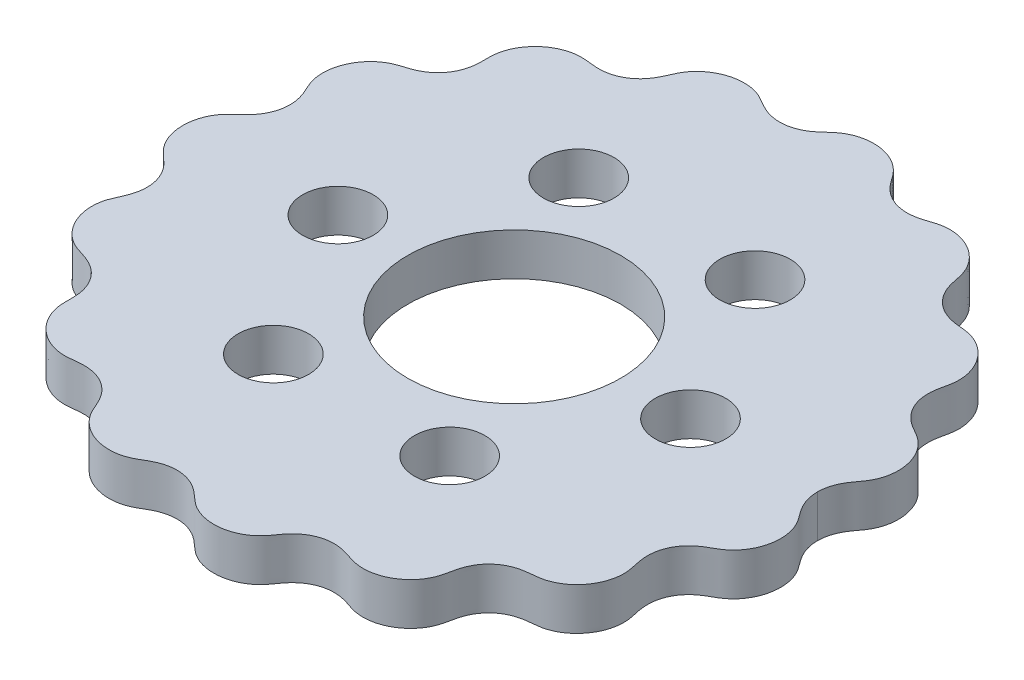
from build123d import *

# Parameters (mm, degrees)
CROQUIS1_R              = 2.5
CROQUIS1_R_2            = 7.55
SALIENTE_EXTRUIR1_DEPTH = 3


with BuildPart() as part:
    # Croquis1 → Saliente-Extruir1 (new body)
    with BuildSketch(Plane(origin=(0, 0, 0), x_dir=(1, 0, 0), z_dir=(0, 1, 0))):
        with BuildLine():
            add(Edge.make_bspline(
                [(21.5, 6e-09), (21.5, -0.021477729), (21.500593167, -0.064403657), (21.503262416, -0.141588523), (21.510372598, -0.2506358), (21.521018274, -0.353523789), (21.535175808, -0.452206948), (21.557222906, -0.575017626), (21.590559678, -0.722889607), (21.639274228, -0.892521131), (21.707884543, -1.081968973), (21.78873173, -1.266690221), (21.888386964, -1.460455943), (22.008607626, -1.661555773), (22.149838228, -1.868528125), (22.309357779, -2.08239167), (22.468686481, -2.296354296), (22.616280308, -2.518934735), (22.777295322, -2.811357303), (22.950547935, -3.239521207), (23.075522685, -3.817302999), (23.078537532, -4.534680376), (22.911713253, -5.29055349), (22.610017793, -5.937401244), (22.218532391, -6.456743933), (21.777242179, -6.851918437), (21.32091858, -7.125069015), (20.800006514, -7.402592951), (20.275278853, -7.794795834), (19.806259526, -8.344649339), (19.47501305, -9.061365972), (19.359808776, -9.783237796), (19.409811075, -10.45223525), (19.534571948, -10.974738813), (19.622228568, -11.37394657), (19.66331962, -11.780870884), (19.655235202, -12.25104806), (19.539094715, -12.841606724), (19.252298774, -13.507573669), (18.793656717, -14.136374174), (18.262226158, -14.603366894), (17.710139852, -14.916745352), (17.169916613, -15.100032746), (16.669993727, -15.175429226), (16.191607921, -15.204772861), (15.741139447, -15.278537815), (15.326751026, -15.399790897), (14.95430103, -15.566061405), (14.526377994, -15.833151099), (14.082742171, -16.242840318), (13.724187686, -16.776104917), (13.513969977, -17.343953181), (13.412285649, -17.804901498), (13.335129122, -18.208112885), (13.235903541, -18.607442974), (13.024991152, -19.108148449), (12.641574276, -19.662684796), (12.102803702, -20.165182222), (11.412158232, -20.563926572), (10.707597414, -20.779266856), (10.035646399, -20.83404745), (9.496566569, -20.766350177), (9.101123729, -20.652617048), (8.713354253, -20.51783079), (8.26331895, -20.375418001), (7.666439407, -20.273547461), (7.02534099, -20.317432866), (6.448722445, -20.496787609), (6.003453554, -20.733835755), (5.673235715, -20.973250267), (5.36103011, -21.271497292), (5.071919671, -21.624726769), (4.807303774, -22.024358247), (4.49206196, -22.419593303), (4.063197476, -22.795814727), (3.515795305, -23.117216867), (2.845595233, -23.344001375), (2.071809166, -23.426718685), (1.351516933, -23.342234872), (0.782242843, -23.147337041), (0.370660405, -22.919550473), (0.094685369, -22.719855647), (-0.112499956, -22.543041557), (-0.361255998, -22.310815394), (-0.709987364, -21.997177169), (-1.207154424, -21.657522052), (-1.890267706, -21.396651069), (-2.676362953, -21.324976244), (-3.387209553, -21.456352261), (-3.989119414, -21.714595035), (-4.490013096, -22.027017012), (-4.95463778, -22.285583422), (-5.517629492, -22.470210474), (-6.162961234, -22.549513553), (-6.874275188, -22.487459807), (-7.611850898, -22.253851382), (-8.232306441, -21.892779921), (-8.718814605, -21.450179098), (-9.074410076, -20.96965434), (-9.30447343, -20.486366652), (-9.527824595, -19.92805394), (-9.870121296, -19.346772049), (-10.386478443, -18.807409124), (-11.094454857, -18.398658751), (-11.819735425, -18.221161807), (-12.49428866, -18.215365114), (-13.089477234, -18.301093688), (-13.623048326, -18.343496822), (-14.21699271, -18.27580449), (-14.843550347, -18.075776473), (-15.466475178, -17.718981941), (-16.037573861, -17.197026852), (-16.446970964, -16.612037769), (-16.700958346, -16.013512551), (-16.822562499, -15.433633895), (-16.830949734, -14.901973921), (-16.810831257, -14.311976259), (-16.888141304, -13.661585672), (-17.129789761, -12.980286404), (-17.584909408, -12.335345436), (-18.152387269, -11.874187352), (-18.695120227, -11.613455805), (-19.141105511, -11.468264348), (-19.466595489, -11.368949051), (-19.72331714, -11.277927034), (-20.034239483, -11.138775287), (-20.437309899, -10.896223894), (-20.890715901, -10.500673536), (-21.32405404, -9.919114011), (-21.639271927, -9.207651873), (-21.778031598, -8.513826596), (-21.773294873, -7.879097024), (-21.662068141, -7.319519537), (-21.477099649, -6.849009046), (-21.21864487, -6.328872243), (-21.001094133, -5.703528424), (-20.921421707, -4.967979091), (-21.045380365, -4.26573249), (-21.28557638, -3.712099987), (-21.5435831, -3.324338564), (-21.759158587, -3.06741441), (-21.974004689, -2.851533582), (-22.177475655, -2.6682982), (-22.384365506, -2.489012482), (-22.584474732, -2.301946971), (-22.769345598, -2.099508481), (-22.935201075, -1.881254997), (-23.0966794, -1.622900682), (-23.24464012, -1.322198439), (-23.343738868, -1.047696955), (-23.406898759, -0.80892307), (-23.441285745, -0.638690065), (-23.458128376, -0.541225552), (-23.475672645, -0.420048085), (-23.491111314, -0.279516), (-23.498128683, -0.126374918), (-23.5, -0.042162775), (-23.5, 0)],
                knots=[0.072614965, 0.072614965, 0.072614965, 0.072614965, 0.072614965, 0.073703014, 0.074791062, 0.075879111, 0.076967159, 0.078055207, 0.079143256, 0.081319353, 0.08349545, 0.085671547, 0.087847644, 0.090023741, 0.092905568, 0.095787396, 0.098669224, 0.101551051, 0.104432879, 0.107314706, 0.113078361, 0.121440052, 0.129801742, 0.13803881, 0.146275878, 0.152004582, 0.157733286, 0.16346199, 0.169190694, 0.177516814, 0.185842935, 0.194348232, 0.20285353, 0.208734111, 0.214614693, 0.217554984, 0.220495275, 0.226375857, 0.234870229, 0.243364601, 0.25155232, 0.259740038, 0.265182119, 0.270624199, 0.27606628, 0.28150836, 0.285899123, 0.290289886, 0.294680648, 0.299071411, 0.307626277, 0.316181144, 0.322095843, 0.325053193, 0.328010542, 0.333925241, 0.33983994, 0.348383698, 0.356927456, 0.365471214, 0.374014972, 0.379929671, 0.38584437, 0.38880172, 0.391759069, 0.397673769, 0.406228635, 0.414783502, 0.419174264, 0.423565027, 0.42795579, 0.432346552, 0.437788633, 0.443230713, 0.448672794, 0.454114874, 0.462302593, 0.470490311, 0.478984683, 0.487479056, 0.493359637, 0.496299928, 0.499240219, 0.50218051, 0.505120801, 0.511001383, 0.51950668, 0.528011978, 0.536338098, 0.544664219, 0.550392923, 0.556121627, 0.561850331, 0.567579035, 0.575816103, 0.58405317, 0.592414861, 0.600776551, 0.606540206, 0.612303862, 0.618067517, 0.623831172, 0.63253556, 0.641239948, 0.649944335, 0.658648723, 0.664412378, 0.670176034, 0.675939689, 0.681703344, 0.690065034, 0.698426725, 0.706663792, 0.71490086, 0.720629564, 0.726358268, 0.732086972, 0.737815676, 0.746141797, 0.754467917, 0.762973215, 0.771478512, 0.777359094, 0.780299385, 0.783239676, 0.786179967, 0.789120258, 0.795000839, 0.803495212, 0.811989584, 0.820177302, 0.828365021, 0.833807101, 0.839249182, 0.844691262, 0.850133343, 0.858914868, 0.867696393, 0.87625126, 0.880528693, 0.884806126, 0.887763476, 0.890720826, 0.893678175, 0.896635525, 0.899592874, 0.902550224, 0.905507573, 0.908464923, 0.912736802, 0.917008681, 0.918076651, 0.91914462, 0.92021259, 0.92128056, 0.923416499, 0.925552439, 0.925552439, 0.925552439, 0.925552439, 0.925552439], degree=4))
            add(Edge.make_bspline(
                [(21.5, 6e-09), (21.5, 0.021477735), (21.500593167, 0.064403663), (21.503262416, 0.141588528), (21.510372598, 0.250635805), (21.521018274, 0.353523794), (21.535175808, 0.452206954), (21.557222906, 0.575017631), (21.590559678, 0.722889613), (21.639274228, 0.892521136), (21.707884543, 1.081968978), (21.788731729, 1.266690226), (21.888386964, 1.460455948), (22.008607626, 1.661555778), (22.149838228, 1.86852813), (22.309357779, 2.082391676), (22.468686481, 2.296354301), (22.616280308, 2.518934741), (22.777295322, 2.811357309), (22.950547935, 3.239521212), (23.075522685, 3.817303005), (23.078537532, 4.534680382), (22.911713252, 5.290553496), (22.610017792, 5.937401249), (22.21853239, 6.456743939), (21.777242178, 6.851918442), (21.320918579, 7.12506902), (20.800006513, 7.402592956), (20.275278852, 7.794795839), (19.806259525, 8.344649344), (19.475013049, 9.061365977), (19.359808775, 9.783237801), (19.409811074, 10.452235255), (19.534571947, 10.974738818), (19.622228566, 11.373946575), (19.663319619, 11.780870889), (19.655235201, 12.251048065), (19.539094713, 12.841606729), (19.252298772, 13.507573674), (18.793656715, 14.136374179), (18.262226156, 14.603366898), (17.71013985, 14.916745357), (17.16991661, 15.100032751), (16.669993725, 15.175429231), (16.191607919, 15.204772865), (15.741139445, 15.27853782), (15.326751024, 15.399790901), (14.954301028, 15.566061409), (14.526377991, 15.833151104), (14.082742169, 16.242840322), (13.724187683, 16.776104921), (13.513969975, 17.343953186), (13.412285647, 17.804901503), (13.33512912, 18.20811289), (13.235903538, 18.607442978), (13.024991149, 19.108148453), (12.641574273, 19.6626848), (12.102803699, 20.165182226), (11.41215823, 20.563926576), (10.707597412, 20.77926686), (10.035646396, 20.834047454), (9.496566566, 20.766350181), (9.101123726, 20.652617052), (8.71335425, 20.517830793), (8.263318947, 20.375418004), (7.666439405, 20.273547465), (7.025340987, 20.317432869), (6.448722442, 20.496787613), (6.003453551, 20.733835759), (5.673235712, 20.97325027), (5.361030107, 21.271497296), (5.071919668, 21.624726772), (4.807303771, 22.02435825), (4.492061957, 22.419593306), (4.063197472, 22.79581473), (3.515795302, 23.11721687), (2.845595229, 23.344001378), (2.071809163, 23.426718687), (1.35151693, 23.342234874), (0.782242839, 23.147337044), (0.370660402, 22.919550475), (0.094685366, 22.719855649), (-0.112499959, 22.543041559), (-0.361256001, 22.310815396), (-0.709987367, 21.997177172), (-1.207154427, 21.657522054), (-1.890267709, 21.396651071), (-2.676362956, 21.324976246), (-3.387209556, 21.456352263), (-3.989119417, 21.714595036), (-4.490013099, 22.027017014), (-4.954637783, 22.285583424), (-5.517629495, 22.470210476), (-6.162961237, 22.549513555), (-6.874275191, 22.487459809), (-7.611850901, 22.253851383), (-8.232306444, 21.892779922), (-8.718814608, 21.450179099), (-9.074410079, 20.969654341), (-9.304473433, 20.486366653), (-9.527824597, 19.928053942), (-9.870121299, 19.34677205), (-10.386478445, 18.807409125), (-11.094454859, 18.398658752), (-11.819735428, 18.221161808), (-12.494288663, 18.215365115), (-13.089477237, 18.301093688), (-13.623048329, 18.343496823), (-14.216992712, 18.275804491), (-14.843550349, 18.075776474), (-15.466475181, 17.718981941), (-16.037573864, 17.197026853), (-16.446970966, 16.61203777), (-16.700958348, 16.013512551), (-16.822562501, 15.433633895), (-16.830949736, 14.901973921), (-16.810831259, 14.311976259), (-16.888141306, 13.661585672), (-17.129789762, 12.980286404), (-17.584909409, 12.335345436), (-18.152387271, 11.874187352), (-18.695120229, 11.613455805), (-19.141105513, 11.468264347), (-19.46659549, 11.368949051), (-19.723317141, 11.277927034), (-20.034239484, 11.138775286), (-20.4373099, 10.896223893), (-20.890715903, 10.500673536), (-21.324054042, 9.919114011), (-21.639271928, 9.207651873), (-21.778031599, 8.513826596), (-21.773294874, 7.879097023), (-21.662068142, 7.319519537), (-21.47709965, 6.849009045), (-21.218644871, 6.328872242), (-21.001094134, 5.703528423), (-20.921421708, 4.967979091), (-21.045380365, 4.26573249), (-21.28557638, 3.712099986), (-21.5435831, 3.324338564), (-21.759158587, 3.06741441), (-21.974004689, 2.851533582), (-22.177475655, 2.668298199), (-22.384365506, 2.489012482), (-22.584474732, 2.30194697), (-22.769345598, 2.09950848), (-22.935201076, 1.881254996), (-23.0966794, 1.622900681), (-23.24464012, 1.322198438), (-23.343738868, 1.047696955), (-23.406898759, 0.808923069), (-23.441285746, 0.638690065), (-23.458128376, 0.541225551), (-23.475672645, 0.420048084), (-23.491111314, 0.279515999), (-23.498128683, 0.126374917), (-23.5, 0.042162774), (-23.5, 0)],
                knots=[0.072614965, 0.072614965, 0.072614965, 0.072614965, 0.072614965, 0.073703014, 0.074791062, 0.075879111, 0.076967159, 0.078055207, 0.079143256, 0.081319353, 0.08349545, 0.085671547, 0.087847644, 0.090023741, 0.092905568, 0.095787396, 0.098669224, 0.101551051, 0.104432879, 0.107314706, 0.113078361, 0.121440052, 0.129801742, 0.13803881, 0.146275878, 0.152004582, 0.157733286, 0.16346199, 0.169190694, 0.177516814, 0.185842935, 0.194348232, 0.20285353, 0.208734111, 0.214614693, 0.217554984, 0.220495275, 0.226375857, 0.234870229, 0.243364601, 0.25155232, 0.259740038, 0.265182119, 0.270624199, 0.27606628, 0.28150836, 0.285899123, 0.290289886, 0.294680648, 0.299071411, 0.307626277, 0.316181144, 0.322095843, 0.325053193, 0.328010542, 0.333925241, 0.33983994, 0.348383698, 0.356927456, 0.365471214, 0.374014972, 0.379929671, 0.38584437, 0.38880172, 0.391759069, 0.397673769, 0.406228635, 0.414783502, 0.419174264, 0.423565027, 0.42795579, 0.432346552, 0.437788633, 0.443230713, 0.448672794, 0.454114874, 0.462302593, 0.470490311, 0.478984683, 0.487479056, 0.493359637, 0.496299928, 0.499240219, 0.50218051, 0.505120801, 0.511001383, 0.51950668, 0.528011978, 0.536338098, 0.544664219, 0.550392923, 0.556121627, 0.561850331, 0.567579035, 0.575816103, 0.58405317, 0.592414861, 0.600776551, 0.606540206, 0.612303862, 0.618067517, 0.623831172, 0.63253556, 0.641239948, 0.649944335, 0.658648723, 0.664412378, 0.670176034, 0.675939689, 0.681703344, 0.690065034, 0.698426725, 0.706663792, 0.71490086, 0.720629564, 0.726358268, 0.732086972, 0.737815676, 0.746141797, 0.754467917, 0.762973215, 0.771478512, 0.777359094, 0.780299385, 0.783239676, 0.786179967, 0.789120258, 0.795000839, 0.803495212, 0.811989584, 0.820177302, 0.828365021, 0.833807101, 0.839249182, 0.844691262, 0.850133343, 0.858914868, 0.867696393, 0.87625126, 0.880528693, 0.884806126, 0.887763476, 0.890720826, 0.893678175, 0.896635525, 0.899592874, 0.902550224, 0.905507573, 0.908464923, 0.912736802, 0.917008681, 0.918076651, 0.91914462, 0.92021259, 0.92128056, 0.923416499, 0.925552439, 0.925552439, 0.925552439, 0.925552439, 0.925552439], degree=4))
        make_face()
        with Locations(Location((12.5, 0, 0), (0, 0, 270))):
            Circle(CROQUIS1_R, mode=Mode.SUBTRACT)
        with Locations(Location((6.25, -10.825317547, 0), (0, 0, 270))):
            Circle(CROQUIS1_R, mode=Mode.SUBTRACT)
        with Locations(Location((-6.25, -10.825317547, 0), (0, 0, 270))):
            Circle(CROQUIS1_R, mode=Mode.SUBTRACT)
        with Locations(Location((-12.5, 0, 0), (0, 0, 270))):
            Circle(CROQUIS1_R, mode=Mode.SUBTRACT)
        with Locations(Location((-6.25, 10.825317547, 0), (0, 0, 270))):
            Circle(CROQUIS1_R, mode=Mode.SUBTRACT)
        with Locations(Location((6.25, 10.825317547, 0), (0, 0, 270))):
            Circle(CROQUIS1_R, mode=Mode.SUBTRACT)
        with Locations(Location((0, 0, 0), (0, 0, 270))):
            Circle(CROQUIS1_R_2, mode=Mode.SUBTRACT)
    extrude(amount=SALIENTE_EXTRUIR1_DEPTH)


solid = part.part
